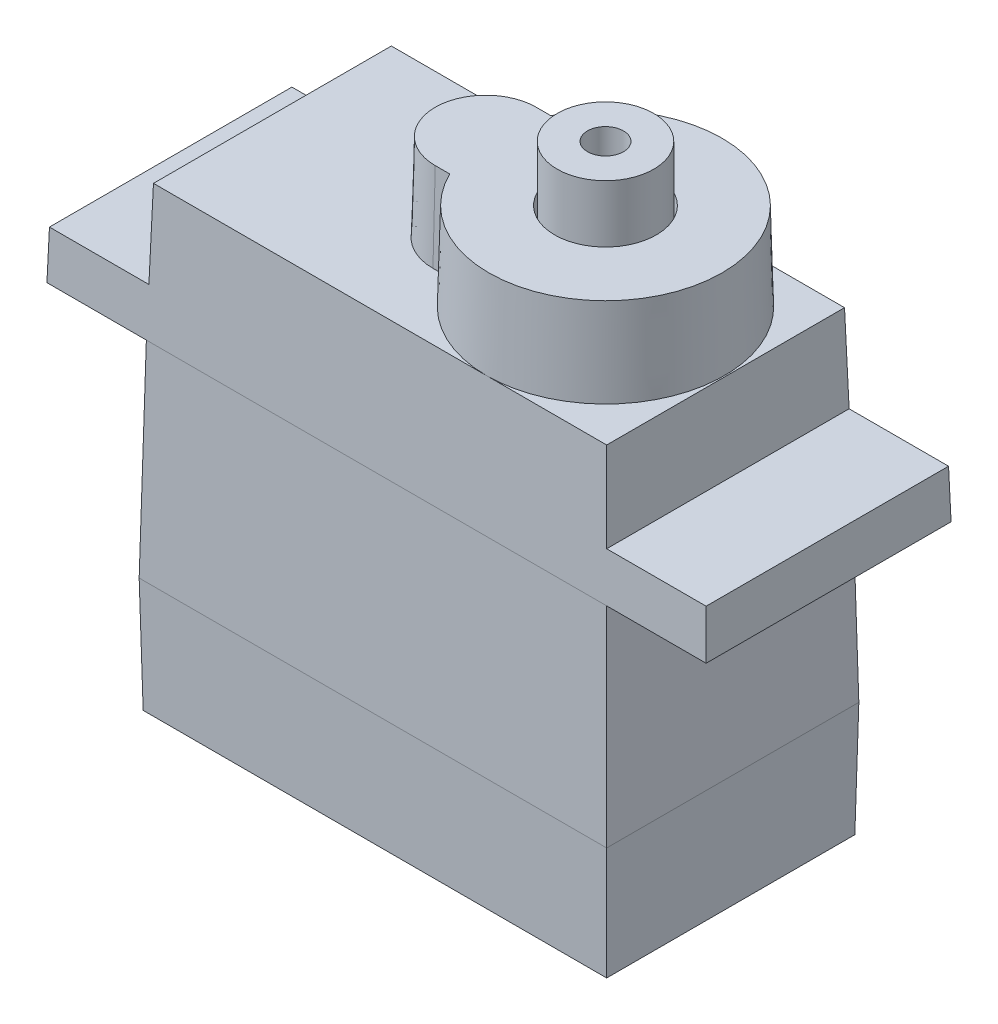
from build123d import *

# Parameters (mm, degrees)
SKETCH8_W                 = 32.5
SKETCH8_H                 = 12.0777
BODY_MOUNTING_PLATE_DEPTH = 2.3749
SKETCH9_W                 = 22.6949
SKETCH9_H                 = 12.0777
BODY_TOP_DEPTH            = 4.318
BODY_TOP_DRAFT_1_5_ANGLE  = -1.5
SKETCH10_W                = 22.6949
SKETCH10_H                = 12.0777
BODY_MIDDLE_DEPTH         = 10.16
BODY_MIDDLE_DRAFT         = -1
SKETCH11_W                = 23.04958692
SKETCH11_H                = 12.43238692
BODY_BODOM_DEPTH          = 5.6515
BODY_BODOM_TAPER          = 1
BODY_TOPPER_DEPTH         = 4.3307
BODY_TOPPER_TAPER         = 1.5
SKETCH13_R                = 2.38125
SPINDLE_DEPTH             = 2.7432
SPINDLE_START             = -3.175
SKETCH18_R                = 2.50825
SKETCH18_R_2              = 2.38125
SPINDLE_OPENING_DEPTH     = 3.175
SKETCH14_R                = 0.889
SPINDLE_SCREW_HOLE_DEPTH  = 6.35


with BuildPart() as part:
    # Sketch8 → Body Mounting Plate (new body)
    with BuildSketch(Plane(origin=(0, 0, 0), x_dir=(1, 0, 0), z_dir=(0, 1, 0))):
        Rectangle(SKETCH8_W, SKETCH8_H)
    extrude(amount=BODY_MOUNTING_PLATE_DEPTH)

    # Sketch9 → Body Top (add)
    with BuildSketch(Plane(origin=(0, 2.3749, 0), x_dir=(1, 0, 0), z_dir=(0, 1, 0))):
        Rectangle(SKETCH9_W, SKETCH9_H)
    extrude(amount=BODY_TOP_DEPTH)

    # Body Top Draft 1.5
    body_top_draft_1_5_faces = [part.faces().sort_by_distance(p)[0] for p in [
        (11.34745, 4.5339, 0),
        (16.25, 1.18745, 0),
        (0, 3.059462209, -6.03885),
        (-11.34745, 4.5339, 0),
        (-16.25, 1.18745, 0),
        (0, 3.059462209, 6.03885),
    ]]
    draft(body_top_draft_1_5_faces, Plane(origin=(0, 0, 0), x_dir=(0, 0, -1), z_dir=(0, -1, 0)), BODY_TOP_DRAFT_1_5_ANGLE)


with BuildPart() as body_middle_tool:
    # Sketch10 → Body Middle (with draft: the straight prism first)
    with BuildSketch(Plane.XZ):
        Rectangle(SKETCH10_W, SKETCH10_H)
    extrude(amount=BODY_MIDDLE_DEPTH)
    # Body Middle: the draft: its side faces are tilted about the plane it starts from
    body_middle_sides = [body_middle_tool.faces().sort_by_distance(p)[0] for p in [
        (0, -5.08, 6.03885),
        (-11.34745, -5.08, 0),
        (0, -5.08, -6.03885),
        (11.34745, -5.08, 0),
    ]]
    draft(body_middle_sides, Plane.XZ, BODY_MIDDLE_DRAFT)


with BuildPart() as part_1:
    add(part.part)

    # Body Middle: add body_middle_tool
    add(body_middle_tool.part)

    # Sketch11 → Body Bodom (add)
    with BuildSketch(Plane.XZ.offset(10.16)):
        Rectangle(SKETCH11_W, SKETCH11_H)
    extrude(amount=BODY_BODOM_DEPTH, taper=BODY_BODOM_TAPER)

    # Sketch12 → Body Topper (add)
    with BuildSketch(Plane(origin=(0, 6.6929, 0), x_dir=(1, 0, 0), z_dir=(0, 1, 0))):
        with BuildLine():
            ThreePointArc((-0.652959754, 2.6035), (-3.256459754, 0), (-0.652959754, -2.6035))
            Line((-0.652959754, -2.6035), (-0.003901247, -2.6035))
            ThreePointArc((-0.003901247, -2.6035), (11.113590246, 0), (-0.003901247, 2.6035))
            Line((-0.003901247, 2.6035), (-0.652959754, 2.6035))
        make_face()
    extrude(amount=BODY_TOPPER_DEPTH, taper=BODY_TOPPER_TAPER)

    # Sketch13 → Spindle (add)
    with BuildSketch(Plane(origin=(0, 11.0236, 0), x_dir=(1, 0, 0), z_dir=(0, 1, 0))):
        with Locations(Location((5.25, 0, 0), (0, 0, 270))):
            Circle(SKETCH13_R)
    extrude(amount=SPINDLE_DEPTH)

    # Sketch18 → Spindle Opening (cut)
    with BuildSketch(Plane(origin=(0, 11.0236, 0), x_dir=(1, 0, 0), z_dir=(0, 1, 0)).offset(SPINDLE_START)):
        with Locations(Location((5.25, 0, 0), (0, 0, 270))):
            Circle(SKETCH18_R)
        with Locations(Location((5.25, 0, 0), (0, 0, 270))):
            Circle(SKETCH18_R_2, mode=Mode.SUBTRACT)
    extrude(amount=SPINDLE_OPENING_DEPTH, mode=Mode.SUBTRACT)

    # Sketch14 → Spindle Screw Hole (cut)
    with BuildSketch(Plane(origin=(0, 13.7668, 0), x_dir=(1, 0, 0), z_dir=(0, 1, 0))):
        with Locations(Location((5.25, 0, 0), (0, 0, 270))):
            Circle(SKETCH14_R)
    extrude(amount=-SPINDLE_SCREW_HOLE_DEPTH, mode=Mode.SUBTRACT)


solid = part_1.part
